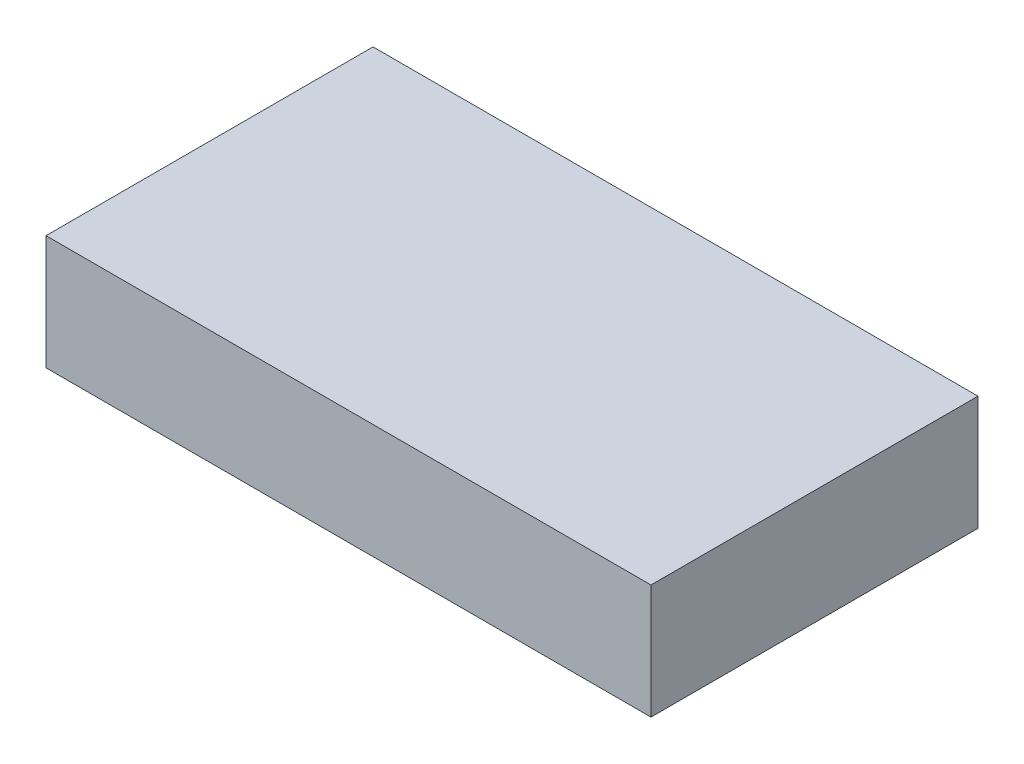
from build123d import *

# Parameters (mm, degrees)
SKETCH1_W           = 185
SKETCH1_H           = 100
BOSS_EXTRUDE1_DEPTH = 35


with BuildPart() as part:
    # Sketch1 → Boss-Extrude1 (new body)
    with BuildSketch(Plane(origin=(0, 0, 0), x_dir=(1, 0, 0), z_dir=(0, 1, 0))):
        with Locations((92.5, 50)):
            Rectangle(SKETCH1_W, SKETCH1_H)
    extrude(amount=BOSS_EXTRUDE1_DEPTH)


solid = part.part
